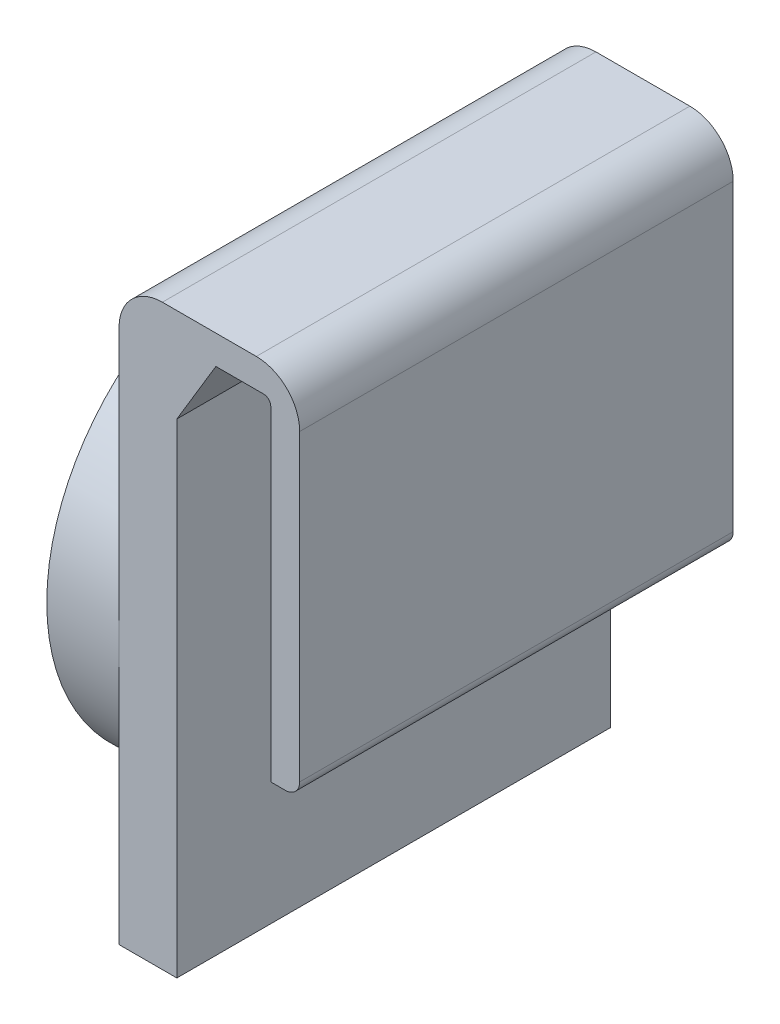
from build123d import *

# Parameters (mm, degrees)
BOSS_EXTRUDE1_DEPTH = 30
FILLET1_R           = 3
FILLET2_R           = 0.5
FILLET3_R           = 1
SKETCH3_R           = 15
BOSS_EXTRUDE2_DEPTH = 5
SKETCH4_R           = 10.5
CUT_EXTRUDE2_DEPTH  = 7


with BuildPart() as part:
    # Sketch1 → Boss-Extrude1 (new body)
    with BuildSketch(Plane.XY):
        Polygon((0, 0), (0, 40), (12.5, 40), (12.5, 15), (10.5, 15), (10.5, 38), (6.7, 38), (4, 33.5), (4, 0), align=None)
    extrude(amount=BOSS_EXTRUDE1_DEPTH)

    # Fillet1
    fillet1_edges = [part.edges().sort_by_distance(p)[0] for p in [
        (0, 40, 15),
        (12.5, 40, 15),
    ]]
    fillet(fillet1_edges, radius=FILLET1_R)

    # Fillet2
    fillet2_edges = [part.edges().sort_by_distance(p)[0] for p in [
        (10.5, 38, 15),
    ]]
    fillet(fillet2_edges, radius=FILLET2_R)

    # Fillet3
    fillet3_edges = [part.edges().sort_by_distance(p)[0] for p in [
        (12.5, 15, 15),
    ]]
    fillet(fillet3_edges, radius=FILLET3_R)

    # Sketch3 → Boss-Extrude2 (add)
    with BuildSketch(Plane.ZY):
        with Locations((15, 18)):
            Circle(SKETCH3_R)
    extrude(amount=BOSS_EXTRUDE2_DEPTH)

    # Sketch4 → Cut-Extrude2 (cut)
    with BuildSketch(Plane.ZY.offset(5)):
        with Locations((15, 18)):
            Circle(SKETCH4_R)
    extrude(amount=-CUT_EXTRUDE2_DEPTH, mode=Mode.SUBTRACT)


solid = part.part
